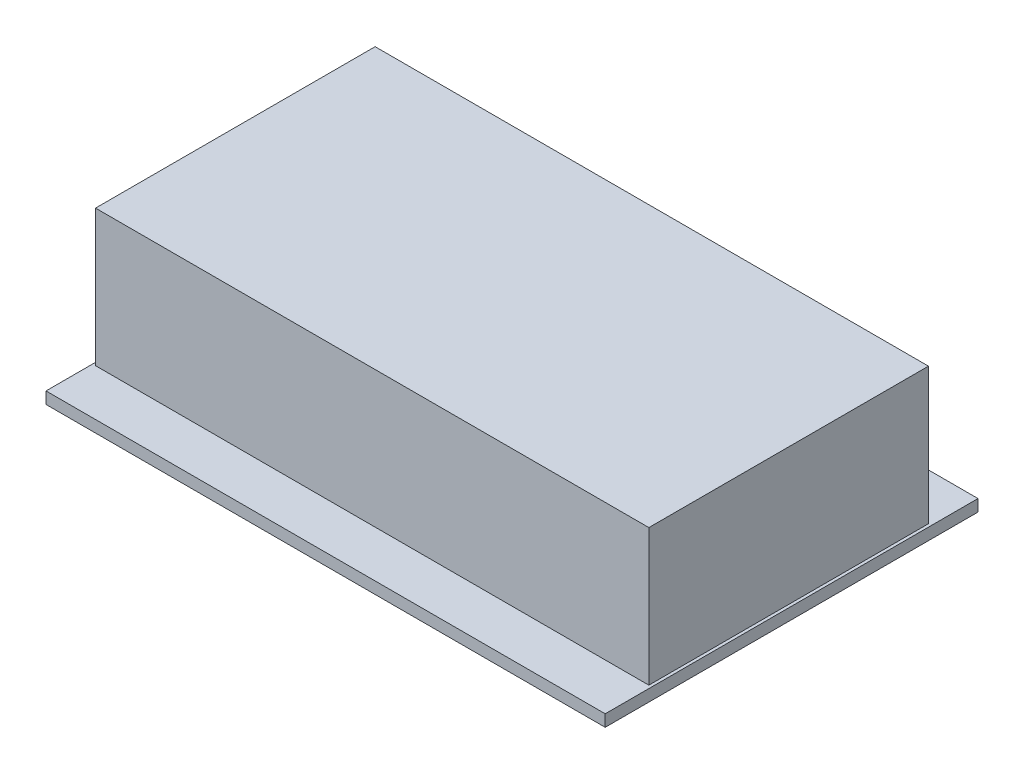
from build123d import *

# Parameters (mm, degrees)
SKETCH1_W           = 76.2
SKETCH1_H           = 50.8
BOSS_EXTRUDE1_DEPTH = 1.6
SKETCH2_W           = 75.4
SKETCH2_H           = 38.1
BOSS_EXTRUDE2_DEPTH = 18.6


with BuildPart() as part:
    # Sketch1 → Boss-Extrude1 (new body)
    with BuildSketch(Plane(origin=(0, 0, 0), x_dir=(1, 0, 0), z_dir=(0, 1, 0))):
        Rectangle(SKETCH1_W, SKETCH1_H)
    extrude(amount=BOSS_EXTRUDE1_DEPTH)

    # Sketch2 → Boss-Extrude2 (add)
    with BuildSketch(Plane(origin=(0, 1.6, 0), x_dir=(1, 0, 0), z_dir=(0, 1, 0))):
        Rectangle(SKETCH2_W, SKETCH2_H)
    extrude(amount=BOSS_EXTRUDE2_DEPTH)


solid = part.part
